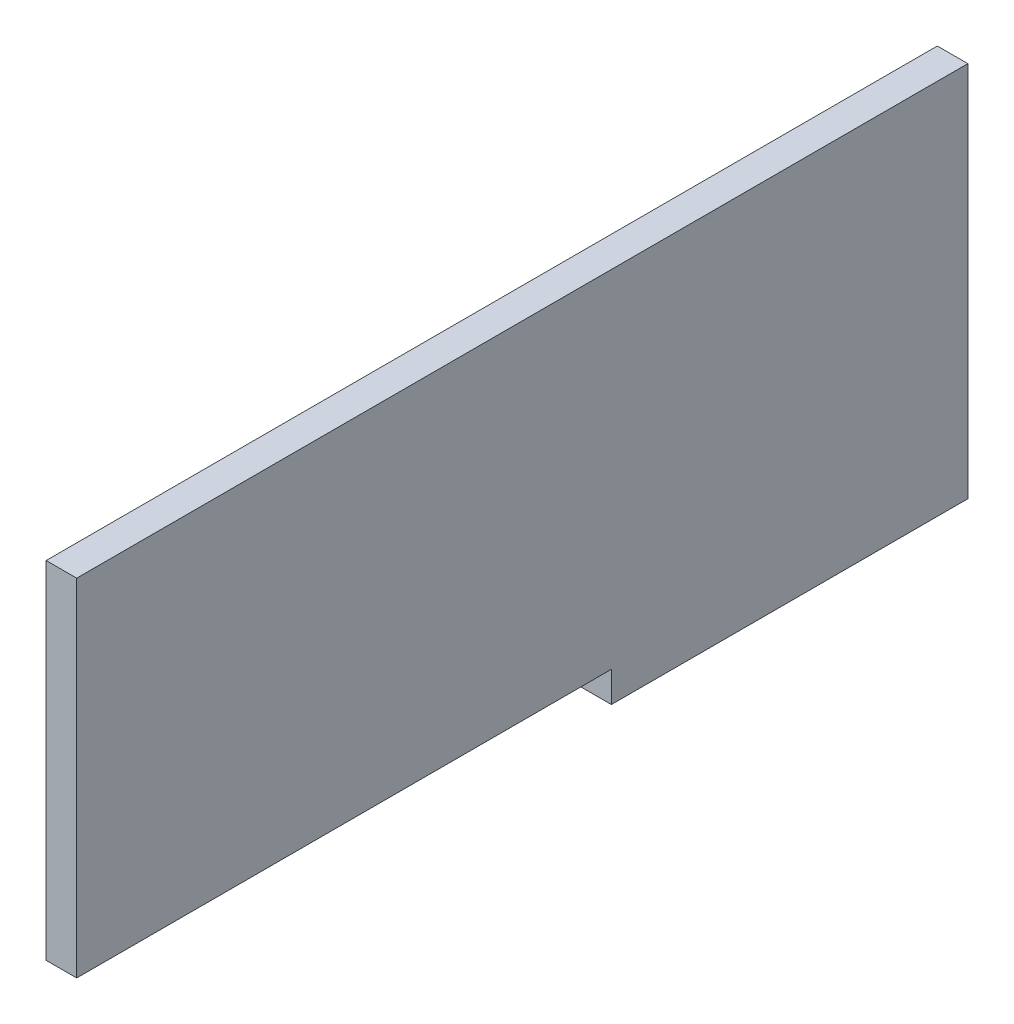
from build123d import *

# Parameters (mm, degrees)
BOSS_EXTRUDE1_DEPTH = 6


with BuildPart() as part:
    # Sketch2 → Boss-Extrude1 (new body)
    with BuildSketch(Plane(origin=(0, 0, 0), x_dir=(0, 0, -1), z_dir=(1, 0, 0))):
        Polygon((-87.5, -34), (17.5, -34), (17.5, -40), (87.5, -40), (87.5, -34), (87.5, 34), (-87.5, 34), align=None)
    extrude(amount=BOSS_EXTRUDE1_DEPTH)


solid = part.part
